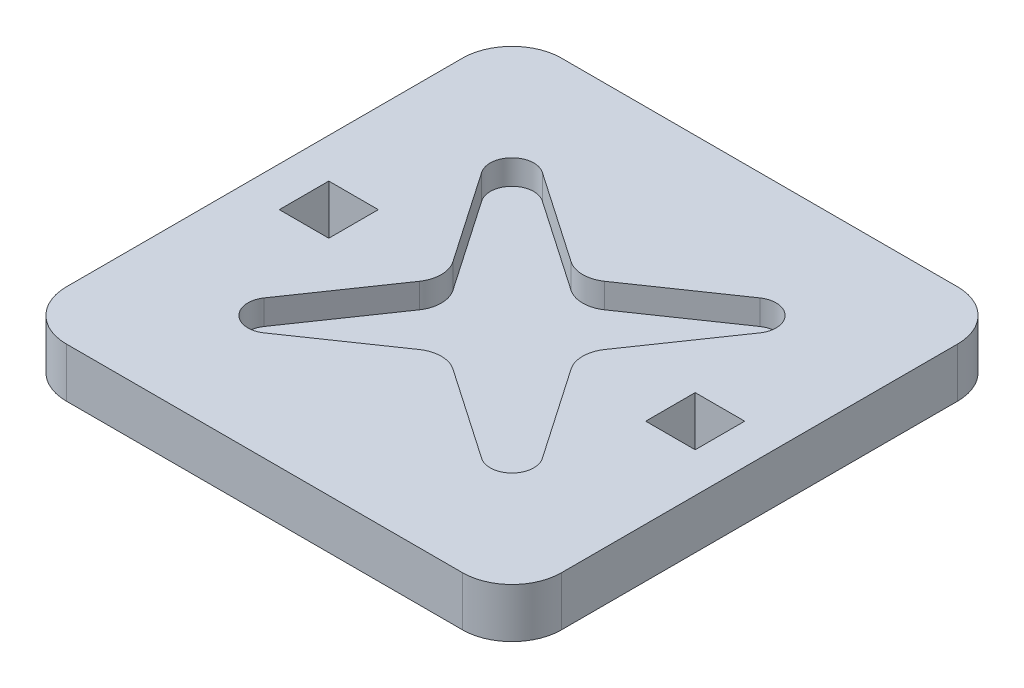
from build123d import *

# Parameters (mm, degrees)
SKETCH2_W           = 5
SKETCH2_H           = 5
BOSS_EXTRUDE1_DEPTH = 5
CUT_EXTRUDE1_DEPTH  = 2.5


with BuildPart() as part:
    # Sketch2 → Boss-Extrude1 (new body)
    with BuildSketch(Plane(origin=(0, 0, 0), x_dir=(1, 0, 0), z_dir=(0, 1, 0))):
        with BuildLine():
            Line((5, 0), (45, 0))
            ThreePointArc((45, 0), (48.535533906, -1.464466094), (50, -5))
            Line((50, -5), (50, -45))
            ThreePointArc((50, -45), (48.535533906, -48.535533906), (45, -50))
            Line((45, -50), (5, -50))
            ThreePointArc((5, -50), (1.464466094, -48.535533906), (0, -45))
            Line((0, -45), (0, -5))
            ThreePointArc((0, -5), (1.464466094, -1.464466094), (5, 0))
        make_face()
        with Locations((6.5, -25)):
            Rectangle(SKETCH2_W, SKETCH2_H, mode=Mode.SUBTRACT)
        with Locations((43.5, -25)):
            Rectangle(SKETCH2_W, SKETCH2_H, mode=Mode.SUBTRACT)
    extrude(amount=BOSS_EXTRUDE1_DEPTH)

    # Sketch4 → Cut-Extrude1 (cut)
    with BuildSketch(Plane(origin=(0, 5, 0), x_dir=(1, 0, 0), z_dir=(0, 1, 0))):
        with BuildLine():
            Line((23.299566157, -17.331191341), (14.010613466, -10.951334614))
            ThreePointArc((14.010613466, -10.951334614), (12.563442924, -10.574062008), (11.209455823, -11.209165249))
            ThreePointArc((11.209455823, -11.209165249), (10.574352582, -12.56315235), (10.951625187, -14.010322893))
            Line((10.951625187, -14.010322893), (17.331481915, -23.299275583))
            ThreePointArc((17.331481915, -23.299275583), (17.858572583, -24.997719905), (17.331481915, -26.696164227))
            Line((17.331481915, -26.696164227), (10.951625187, -35.985116918))
            ThreePointArc((10.951625187, -35.985116918), (10.574352582, -37.43228746), (11.209455823, -38.786274561))
            ThreePointArc((11.209455823, -38.786274561), (12.563442924, -39.421377802), (14.010613466, -39.044105197))
            Line((14.010613466, -39.044105197), (23.299566157, -32.664248469))
            ThreePointArc((23.299566157, -32.664248469), (24.998010479, -32.137157801), (26.696454801, -32.664248469))
            Line((26.696454801, -32.664248469), (35.985407491, -39.044105197))
            ThreePointArc((35.985407491, -39.044105197), (37.432578034, -39.421377802), (38.786565135, -38.786274561))
            ThreePointArc((38.786565135, -38.786274561), (39.421668376, -37.43228746), (39.04439577, -35.985116918))
            Line((39.04439577, -35.985116918), (32.664539043, -26.696164227))
            ThreePointArc((32.664539043, -26.696164227), (32.137448374, -24.997719905), (32.664539043, -23.299275583))
            Line((32.664539043, -23.299275583), (39.04439577, -14.010322893))
            ThreePointArc((39.04439577, -14.010322893), (39.421668376, -12.56315235), (38.786565135, -11.209165249))
            ThreePointArc((38.786565135, -11.209165249), (37.432578034, -10.574062008), (35.985407491, -10.951334614))
            Line((35.985407491, -10.951334614), (26.696454801, -17.331191341))
            ThreePointArc((26.696454801, -17.331191341), (24.998010479, -17.85828201), (23.299566157, -17.331191341))
        make_face()
    extrude(amount=-CUT_EXTRUDE1_DEPTH, mode=Mode.SUBTRACT)


solid = part.part
